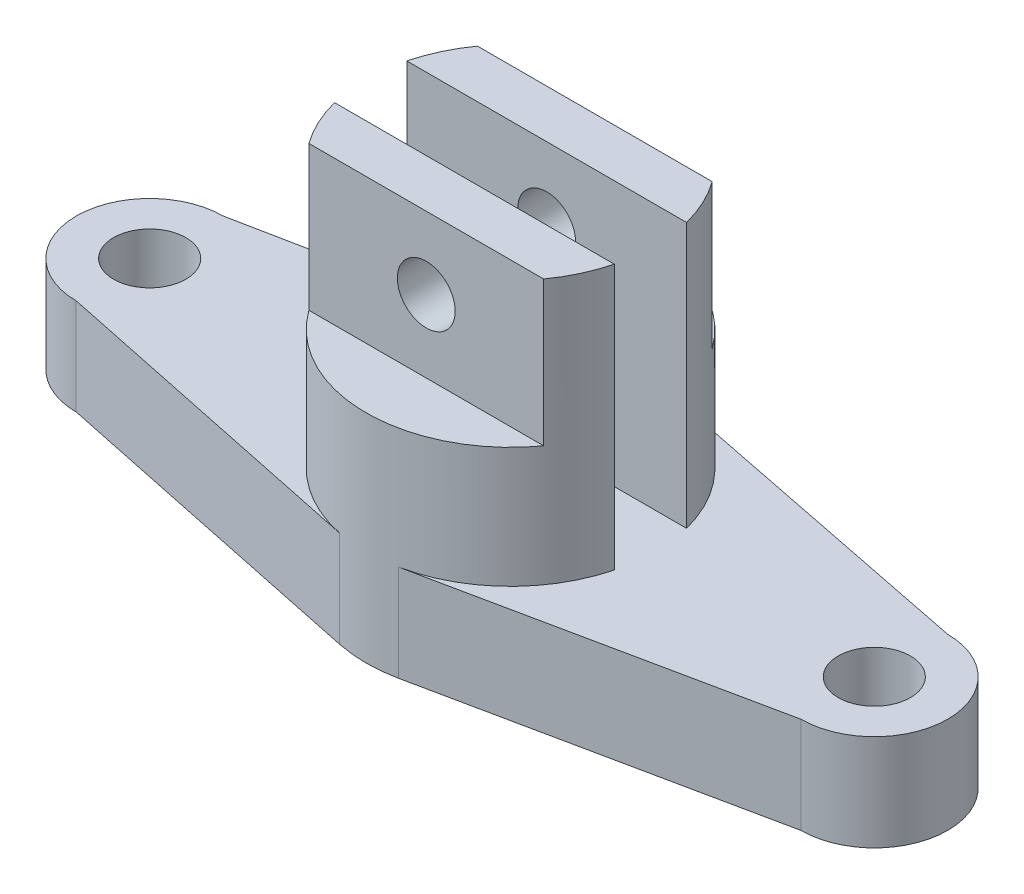
from build123d import *

# Parameters (mm, degrees)
CROQUIS2_R                 = 7.5
SALIENTE_EXTRUIR1_DEPTH    = 20
SALIENTE_EXTRUIR2_START    = 20
SALIENTE_EXTRUIR2_DEPTH    = 25
SALIENTE_EXTRUIR3_START    = 45
SALIENTE_EXTRUIR3_DEPTH    = 30
CORTAR_EXTRUIR1_DEPTH      = 122.287306133
CORTAR_EXTRUIR1_DEPTH_BACK = 122.287306133
CROQUIS4_R                 = 6


with BuildPart() as part:
    # Croquis2 → Saliente-Extruir1 (new body)
    # profile 1 of 5: a face of its own
    with BuildSketch(Plane(origin=(0, 0, 0), x_dir=(1, 0, 0), z_dir=(0, 1, 0))):
        with BuildLine():
            ThreePointArc((-75.223489404, 15.549419201), (-90.474364485, 0.29854412), (-75.223489404, -14.952330962))
            Line((-75.223489404, -14.952330962), (-6.126869665, -29.367694293))
            ThreePointArc((-6.126869665, -29.367694293), (-16.360909149, -25.145986793), (-24.366985862, -17.5))
            ThreePointArc((-24.366985862, -17.5), (-27.171188586, -12.717173855), (-29.047375097, -7.5))
            Line((-29.047375097, -7.5), (29.047375097, -7.5))
            ThreePointArc((29.047375097, -7.5), (27.171188586, -12.717173855), (24.366985862, -17.5))
            ThreePointArc((24.366985862, -17.5), (16.360909149, -25.145986793), (6.126869665, -29.367694293))
            Line((6.126869665, -29.367694293), (75.223489404, -14.952330962))
            ThreePointArc((75.223489404, -14.952330962), (90.474364485, 0.29854412), (75.223489404, 15.549419201))
            Line((75.223489404, 15.549419201), (5.883484054, 29.417420271))
            ThreePointArc((5.883484054, 29.417420271), (16.256658913, 25.213509097), (24.366985862, 17.5))
            ThreePointArc((24.366985862, 17.5), (27.171188586, 12.717173855), (29.047375097, 7.5))
            Line((29.047375097, 7.5), (-29.047375097, 7.5))
            ThreePointArc((-29.047375097, 7.5), (-27.171188586, 12.717173855), (-24.366985862, 17.5))
            ThreePointArc((-24.366985862, 17.5), (-16.256658913, 25.213509097), (-5.883484054, 29.417420271))
            Line((-5.883484054, 29.417420271), (-75.223489404, 15.549419201))
        make_face()
        with Locations(Location((-75.223489404, 0.29854412, 0), (0, 0, 270))):
            Circle(CROQUIS2_R, mode=Mode.SUBTRACT)
        with Locations(Location((75.223489404, 0.29854412, 0), (0, 0, 270))):
            Circle(CROQUIS2_R, mode=Mode.SUBTRACT)
    # profile 2 of 5: a face of its own
    with BuildSketch(Plane(origin=(0, 0, 0), x_dir=(1, 0, 0), z_dir=(0, 1, 0))):
        with BuildLine():
            ThreePointArc((-24.366985862, -17.5), (-16.360909149, -25.145986793), (-6.126869665, -29.367694293))
            ThreePointArc((-6.126869665, -29.367694293), (0, -30), (6.126869665, -29.367694293))
            ThreePointArc((6.126869665, -29.367694293), (16.360909149, -25.145986793), (24.366985862, -17.5))
            Line((24.366985862, -17.5), (-24.366985862, -17.5))
        make_face()
    # profile 3 of 5: a face of its own
    with BuildSketch(Plane(origin=(0, 0, 0), x_dir=(1, 0, 0), z_dir=(0, 1, 0))):
        with BuildLine():
            ThreePointArc((-29.047375097, -7.5), (-27.171188586, -12.717173855), (-24.366985862, -17.5))
            Line((-24.366985862, -17.5), (24.366985862, -17.5))
            ThreePointArc((24.366985862, -17.5), (27.171188586, -12.717173855), (29.047375097, -7.5))
            Line((29.047375097, -7.5), (-29.047375097, -7.5))
        make_face()
    # profile 4 of 5: a face of its own
    with BuildSketch(Plane(origin=(0, 0, 0), x_dir=(1, 0, 0), z_dir=(0, 1, 0))):
        with BuildLine():
            Line((24.366985862, 17.5), (-24.366985862, 17.5))
            ThreePointArc((-24.366985862, 17.5), (-27.171188586, 12.717173855), (-29.047375097, 7.5))
            Line((-29.047375097, 7.5), (29.047375097, 7.5))
            ThreePointArc((29.047375097, 7.5), (27.171188586, 12.717173855), (24.366985862, 17.5))
        make_face()
    # profile 5 of 5: a face of its own
    with BuildSketch(Plane(origin=(0, 0, 0), x_dir=(1, 0, 0), z_dir=(0, 1, 0))):
        with BuildLine():
            ThreePointArc((5.883484054, 29.417420271), (0, 30), (-5.883484054, 29.417420271))
            ThreePointArc((-5.883484054, 29.417420271), (-16.256658913, 25.213509097), (-24.366985862, 17.5))
            Line((-24.366985862, 17.5), (24.366985862, 17.5))
            ThreePointArc((24.366985862, 17.5), (16.256658913, 25.213509097), (5.883484054, 29.417420271))
        make_face()
    extrude(amount=SALIENTE_EXTRUIR1_DEPTH)

    # Croquis2<3> → Saliente-Extruir2 (add)
    with BuildSketch(Plane(origin=(0, 0, 0), x_dir=(1, 0, 0), z_dir=(0, 1, 0)).offset(SALIENTE_EXTRUIR2_START)):
        with BuildLine():
            ThreePointArc((-24.366985862, -17.5), (-16.360909149, -25.145986793), (-6.126869665, -29.367694293))
            ThreePointArc((-6.126869665, -29.367694293), (0, -30), (6.126869665, -29.367694293))
            ThreePointArc((6.126869665, -29.367694293), (16.360909149, -25.145986793), (24.366985862, -17.5))
            Line((24.366985862, -17.5), (-24.366985862, -17.5))
        make_face()
        with BuildLine():
            ThreePointArc((-29.047375097, -7.5), (-27.171188586, -12.717173855), (-24.366985862, -17.5))
            Line((-24.366985862, -17.5), (24.366985862, -17.5))
            ThreePointArc((24.366985862, -17.5), (27.171188586, -12.717173855), (29.047375097, -7.5))
            Line((29.047375097, -7.5), (-29.047375097, -7.5))
        make_face()
        with BuildLine():
            Line((24.366985862, 17.5), (-24.366985862, 17.5))
            ThreePointArc((-24.366985862, 17.5), (-27.171188586, 12.717173855), (-29.047375097, 7.5))
            Line((-29.047375097, 7.5), (29.047375097, 7.5))
            ThreePointArc((29.047375097, 7.5), (27.171188586, 12.717173855), (24.366985862, 17.5))
        make_face()
        with BuildLine():
            ThreePointArc((5.883484054, 29.417420271), (0, 30), (-5.883484054, 29.417420271))
            ThreePointArc((-5.883484054, 29.417420271), (-16.256658913, 25.213509097), (-24.366985862, 17.5))
            Line((-24.366985862, 17.5), (24.366985862, 17.5))
            ThreePointArc((24.366985862, 17.5), (16.256658913, 25.213509097), (5.883484054, 29.417420271))
        make_face()
    extrude(amount=SALIENTE_EXTRUIR2_DEPTH)

    # Croquis2<4> → Saliente-Extruir3 (add)
    with BuildSketch(Plane(origin=(0, 0, 0), x_dir=(1, 0, 0), z_dir=(0, 1, 0)).offset(SALIENTE_EXTRUIR3_START)):
        with BuildLine():
            ThreePointArc((-29.047375097, -7.5), (-27.171188586, -12.717173855), (-24.366985862, -17.5))
            Line((-24.366985862, -17.5), (24.366985862, -17.5))
            ThreePointArc((24.366985862, -17.5), (27.171188586, -12.717173855), (29.047375097, -7.5))
            Line((29.047375097, -7.5), (-29.047375097, -7.5))
        make_face()
        with BuildLine():
            Line((24.366985862, 17.5), (-24.366985862, 17.5))
            ThreePointArc((-24.366985862, 17.5), (-27.171188586, 12.717173855), (-29.047375097, 7.5))
            Line((-29.047375097, 7.5), (29.047375097, 7.5))
            ThreePointArc((29.047375097, 7.5), (27.171188586, 12.717173855), (24.366985862, 17.5))
        make_face()
    extrude(amount=SALIENTE_EXTRUIR3_DEPTH)

    # Croquis4 → Cortar-Extruir1 (cut, two sides: drawn at the far end of the back side and taken through both)
    with BuildSketch(Plane.XY.offset(-CORTAR_EXTRUIR1_DEPTH_BACK)):
        with Locations((0, 60)):
            Circle(CROQUIS4_R)
    extrude(amount=CORTAR_EXTRUIR1_DEPTH + CORTAR_EXTRUIR1_DEPTH_BACK, mode=Mode.SUBTRACT)


solid = part.part
